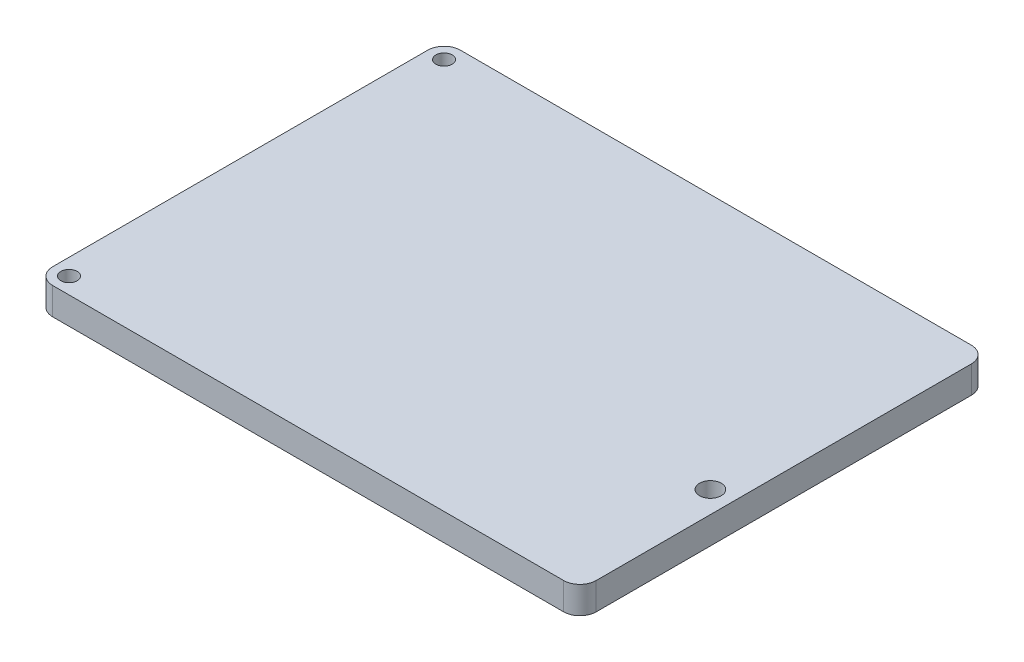
from build123d import *

# Parameters (mm, degrees)
SKETCH_1_R      = 1.5
SKETCH_1_R_2    = 2
EXTRUDE_1_DEPTH = 5


with BuildPart() as part:
    # 草图1 → 凸台-拉伸1 (new body)
    with BuildSketch(Plane(origin=(0, 0, 0), x_dir=(1, 0, 0), z_dir=(0, 1, 0))):
        with BuildLine():
            Line((3, 0), (97, 0))
            ThreePointArc((97, 0), (99.121320344, -0.878679656), (100, -3))
            Line((100, -3), (100, -72))
            ThreePointArc((100, -72), (99.121320344, -74.121320344), (97, -75))
            Line((97, -75), (3, -75))
            ThreePointArc((3, -75), (0.878679656, -74.121320344), (0, -72))
            Line((0, -72), (0, -3))
            ThreePointArc((0, -3), (0.878679656, -0.878679656), (3, 0))
        make_face()
        with Locations(Location((3, -3, 0), (0, 0, 270))):
            Circle(SKETCH_1_R, mode=Mode.SUBTRACT)
        with Locations(Location((3, -72, 0), (0, 0, 270))):
            Circle(SKETCH_1_R, mode=Mode.SUBTRACT)
        with Locations(Location((96, -47, 0), (0, 0, 270))):
            Circle(SKETCH_1_R_2, mode=Mode.SUBTRACT)
    extrude(amount=EXTRUDE_1_DEPTH)


solid = part.part
